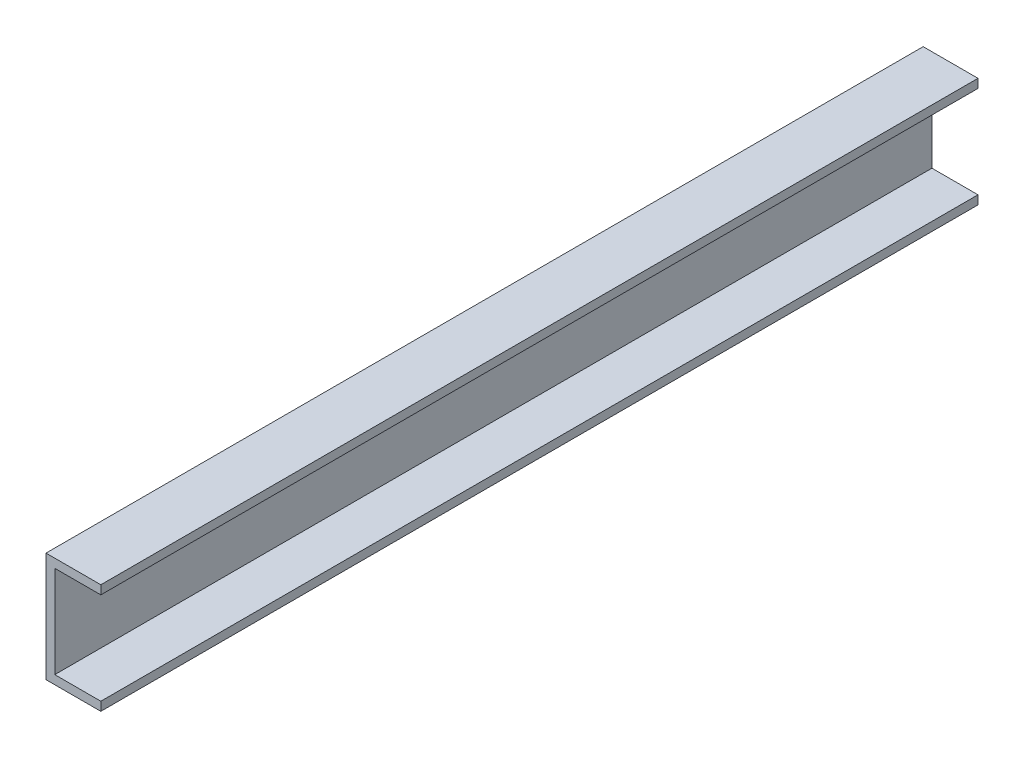
from build123d import *

# Parameters (mm, degrees)
BOSS_EXTRUDE1_DEPTH = 800


with BuildPart() as part:
    # Sketch1 → Boss-Extrude1 (new body)
    with BuildSketch(Plane.XY):
        Polygon((0, 0), (0, 100), (50, 100), (50, 92), (8, 92), (8, 8), (50, 8), (50, 0), align=None)
    extrude(amount=BOSS_EXTRUDE1_DEPTH)


solid = part.part
